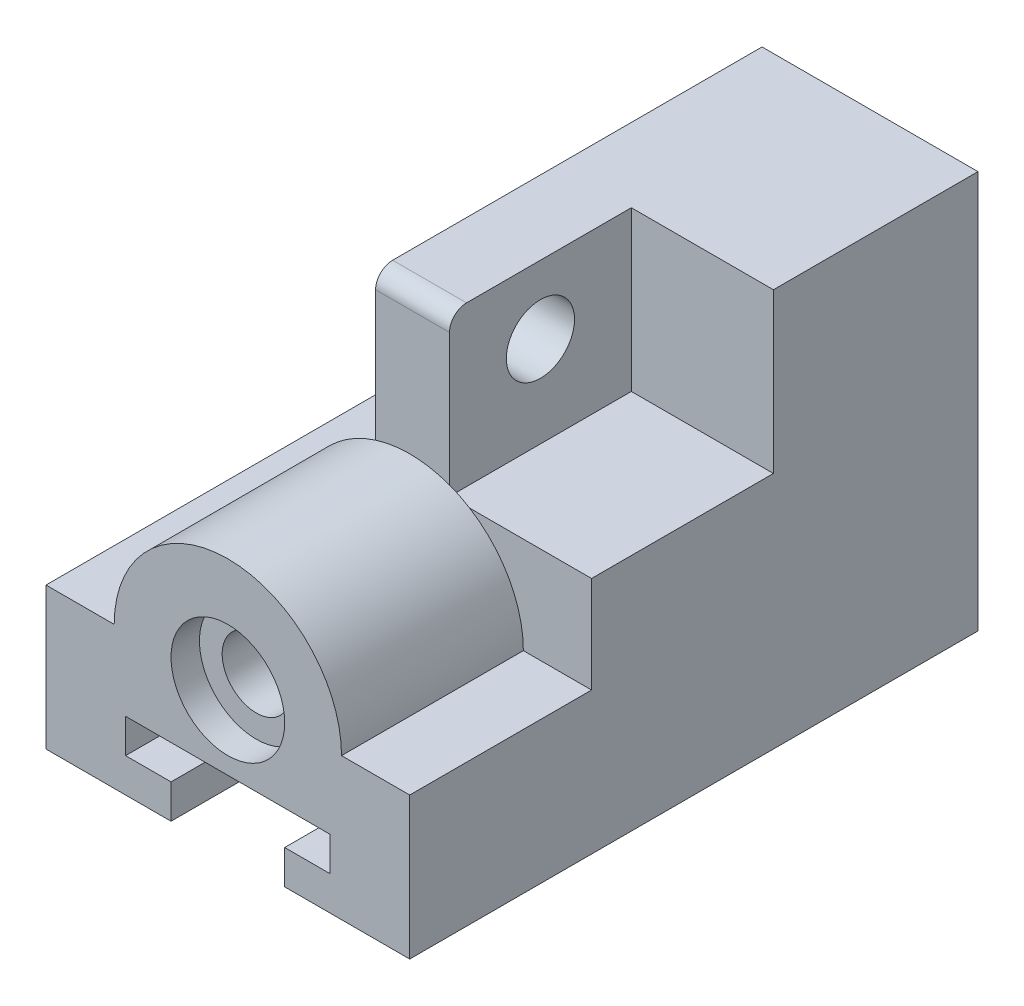
from build123d import *

# Parameters (mm, degrees)
SKETCH1_W                                    = 64
SKETCH1_H                                    = 100
BOSS_EXTRUDE1_DEPTH                          = 25
SKETCH2_W                                    = 38
SKETCH2_H                                    = 68
BOSS_EXTRUDE2_DEPTH                          = 45
SKETCH3_W                                    = 32
SKETCH3_H                                    = 28
CUT_EXTRUDE1_DEPTH                           = 25
BOSS_EXTRUDE3_DEPTH                          = 32
CUT_EXTRUDE2_DEPTH                           = 127.968500031
FILLET1_R                                    = 3
CBORE_FOR_M10_CHEESE_HEAD_SCREW1_D           = 12
CBORE_FOR_M10_CHEESE_HEAD_SCREW1_DEPTH       = 25
CBORE_FOR_M10_CHEESE_HEAD_SCREW1_CBORE_D     = 20
CBORE_FOR_M10_CHEESE_HEAD_SCREW1_CBORE_DEPTH = 5
SKETCH7_R                                    = 6
CUT_EXTRUDE3_DEPTH                           = 117.387284529


with BuildPart() as part:
    # Sketch1 → Boss-Extrude1 (new body)
    with BuildSketch(Plane(origin=(0, 0, 0), x_dir=(1, 0, 0), z_dir=(0, 1, 0))):
        with Locations((32, 50)):
            Rectangle(SKETCH1_W, SKETCH1_H)
    extrude(amount=-BOSS_EXTRUDE1_DEPTH)

    # Sketch2 → Boss-Extrude2 (add)
    with BuildSketch(Plane(origin=(0, 0, 0), x_dir=(1, 0, 0), z_dir=(0, 1, 0))):
        with Locations((45, 66)):
            Rectangle(SKETCH2_W, SKETCH2_H)
    extrude(amount=BOSS_EXTRUDE2_DEPTH)

    # Sketch3 → Cut-Extrude1 (cut)
    with BuildSketch(Plane(origin=(64, 0, 0), x_dir=(0, 0, -1), z_dir=(1, 0, 0))):
        with Locations((48, 31)):
            Rectangle(SKETCH3_W, SKETCH3_H)
    extrude(amount=-CUT_EXTRUDE1_DEPTH, mode=Mode.SUBTRACT)

    # Sketch4 → Boss-Extrude3 (add)
    with BuildSketch(Plane.XY):
        with BuildLine():
            ThreePointArc((52, 0), (32, 20), (12, 0))
            Line((12, 0), (52, 0))
        make_face()
    extrude(amount=-BOSS_EXTRUDE3_DEPTH)

    # Sketch4<3> → Cut-Extrude2 (cut, through all)
    with BuildSketch(Plane.XY):
        Polygon((22, -19), (22, -25), (42, -25), (42, -19), (50, -19), (50, -13), (14, -13), (14, -19), align=None)
    extrude(amount=-CUT_EXTRUDE2_DEPTH, mode=Mode.SUBTRACT)

    # Fillet1
    fillet1_edges = [part.edges().sort_by_distance(p)[0] for p in [
        (32.5, 45, -32),
    ]]
    fillet(fillet1_edges, radius=FILLET1_R)

    # CBORE for M10 Cheese Head Screw1
    with Locations(Plane.XY):
        with Locations((32, 0)):
            CounterBoreHole(CBORE_FOR_M10_CHEESE_HEAD_SCREW1_D / 2, CBORE_FOR_M10_CHEESE_HEAD_SCREW1_CBORE_D / 2, CBORE_FOR_M10_CHEESE_HEAD_SCREW1_CBORE_DEPTH, depth=CBORE_FOR_M10_CHEESE_HEAD_SCREW1_DEPTH)

    # Sketch7 → Cut-Extrude3 (cut, through all)
    with BuildSketch(Plane(origin=(39, 0, 0), x_dir=(0, 0, -1), z_dir=(1, 0, 0))):
        with Locations((48, 33)):
            Circle(SKETCH7_R)
    extrude(amount=-CUT_EXTRUDE3_DEPTH, mode=Mode.SUBTRACT)


solid = part.part
